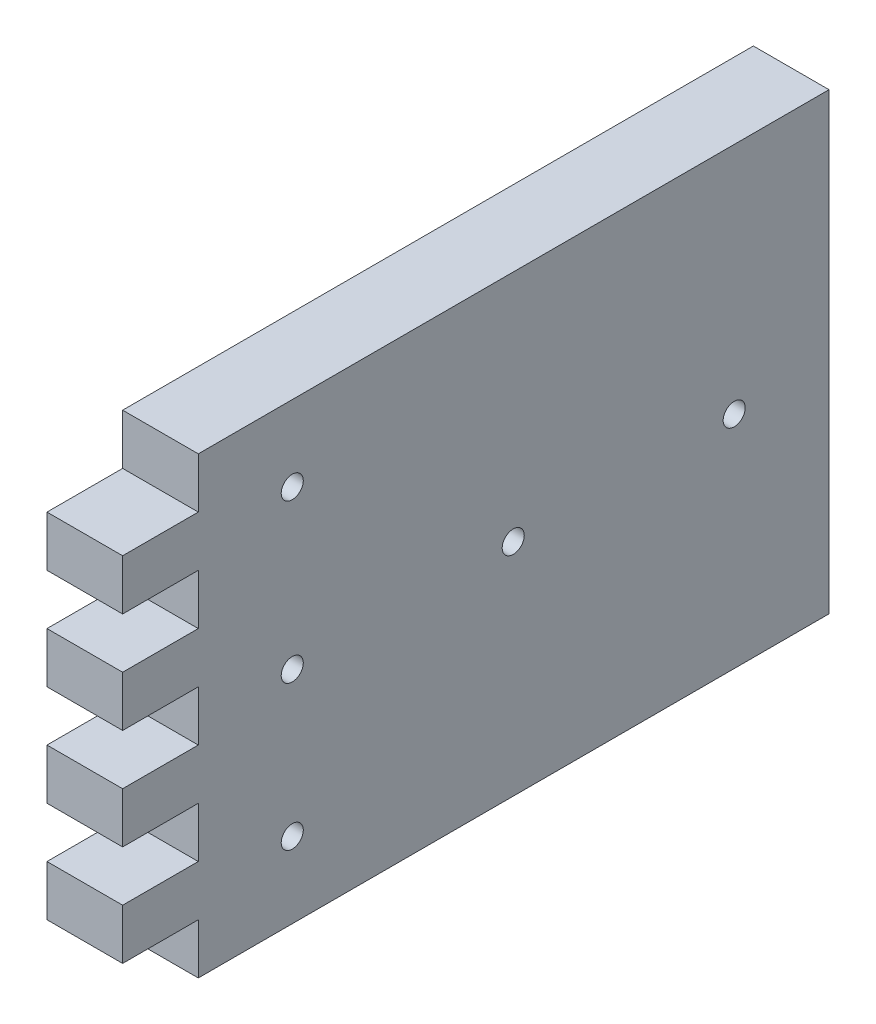
from build123d import *

# Parameters (mm, degrees)
BOSS_EXTRUDE1_DEPTH             = 19.05
F_7_32_0_21875_DIAMETER_HOLE3_D = 5.55625


with BuildPart() as part:
    # Sketch1 → Boss-Extrude1 (new body)
    with BuildSketch(Plane(origin=(0, 0, 0), x_dir=(0, 0, -1), z_dir=(1, 0, 0))):
        Polygon((19.05, 0), (177.8635, 0), (177.8635, 114.3), (19.05, 114.3), (19.05, 101.6), (0, 101.6), (0, 88.9), (19.05, 88.9), (19.05, 76.2), (0, 76.2), (0, 63.5), (19.05, 63.5), (19.05, 50.8), (0, 50.8), (0, 38.1), (19.05, 38.1), (19.05, 25.4), (0, 25.4), (0, 12.7), (19.05, 12.7), align=None)
    extrude(amount=BOSS_EXTRUDE1_DEPTH)

    # 7/32 (0.21875) Diameter Hole3 (through all)
    with Locations(Plane(origin=(19.05, 0, 0), x_dir=(0, 0, -1), z_dir=(1, 0, 0))):
        with Locations((42.7101, 19.05), (153.9875, 55.499), (98.3488, 55.499), (42.7101, 55.499), (42.7101, 95.25)):
            Hole(F_7_32_0_21875_DIAMETER_HOLE3_D / 2)


solid = part.part
